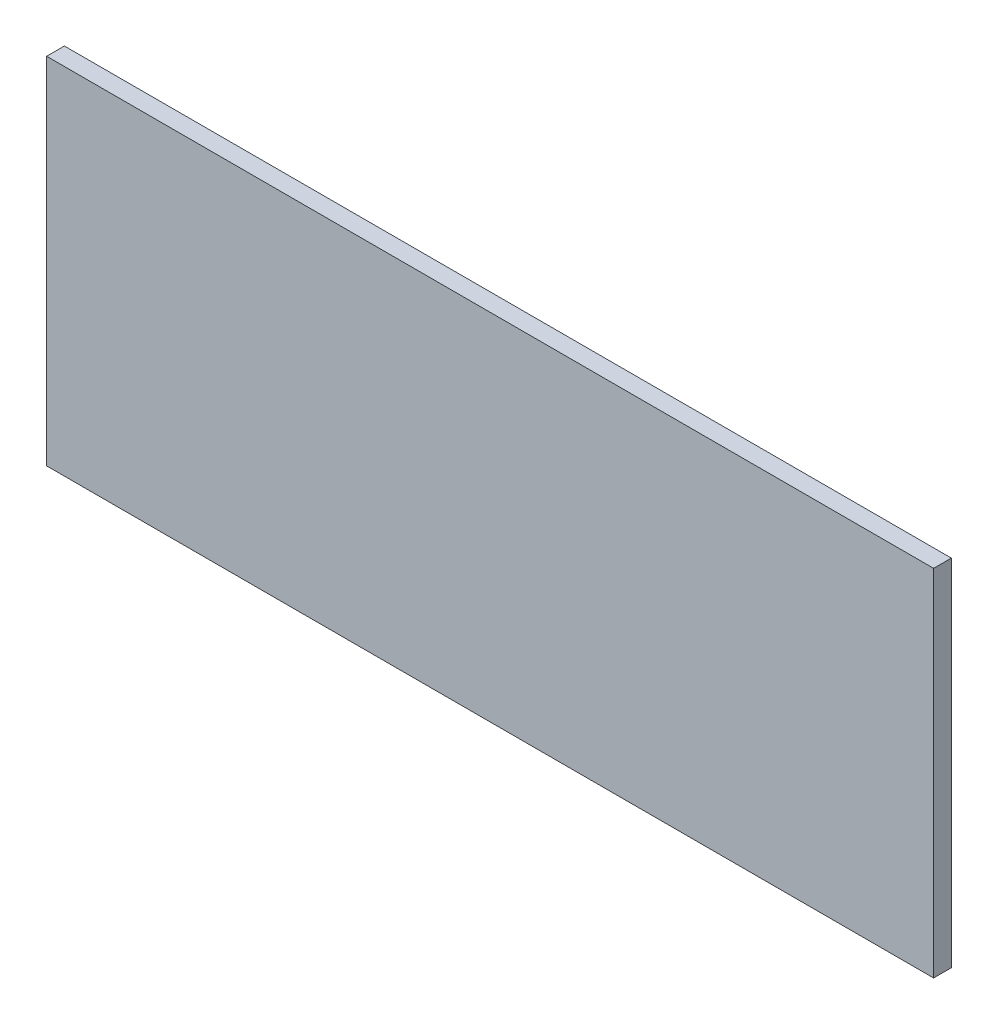
from build123d import *

# Parameters (mm, degrees)
SKETCH1_W           = 250
SKETCH1_H           = 100
BOSS_EXTRUDE1_DEPTH = 5


with BuildPart() as part:
    # Sketch1 → Boss-Extrude1 (new body)
    with BuildSketch(Plane.XY):
        Rectangle(SKETCH1_W, SKETCH1_H)
    extrude(amount=BOSS_EXTRUDE1_DEPTH)


solid = part.part
